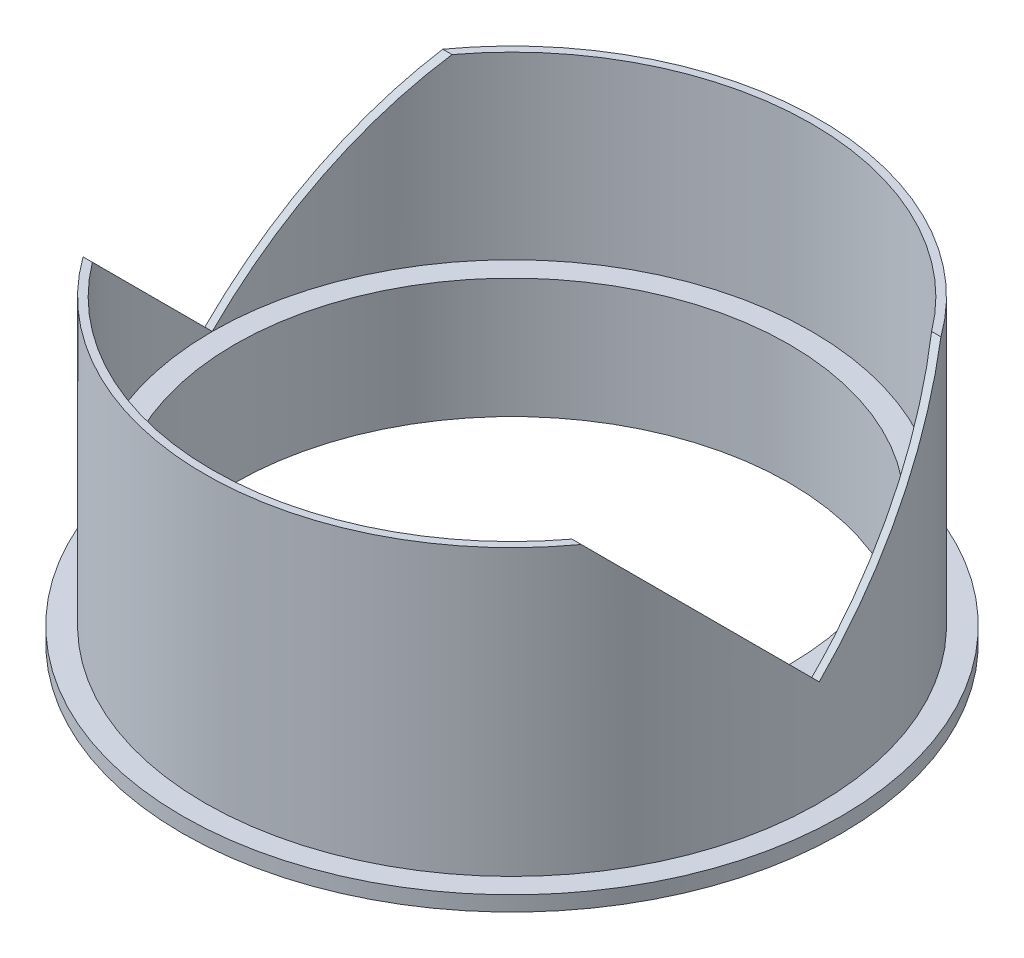
from build123d import *

# Parameters (mm, degrees)
SKETCH1_R               = 127
SKETCH1_R_2             = 117.475
BOSS_EXTRUDE1_DEPTH     = 50.8
SKETCH1_3_R             = 130.175
SKETCH1_3_R_2           = 127
BOSS_EXTRUDE2_DEPTH     = 254
SKETCH1_4_R             = 139.7
SKETCH1_4_R_2           = 130.175
BOSS_EXTRUDE3_DEPTH     = 6.35
SKETCH2_W               = 130.175
SKETCH2_H               = 127
CUT_EXTRUDE1_DEPTH      = 235.864173513
CUT_EXTRUDE1_DEPTH_BACK = 235.864173513


with BuildPart() as part:
    # Sketch1 → Boss-Extrude1 (new body)
    with BuildSketch(Plane(origin=(0, 0, 0), x_dir=(1, 0, 0), z_dir=(0, 1, 0))):
        Circle(SKETCH1_R)
        Circle(SKETCH1_R_2, mode=Mode.SUBTRACT)
    extrude(amount=BOSS_EXTRUDE1_DEPTH)

    # Sketch1<3> → Boss-Extrude2 (add)
    with BuildSketch(Plane(origin=(0, 0, 0), x_dir=(1, 0, 0), z_dir=(0, 1, 0))):
        Circle(SKETCH1_3_R)
        Circle(SKETCH1_3_R_2, mode=Mode.SUBTRACT)
    extrude(amount=BOSS_EXTRUDE2_DEPTH)

    # Sketch1<4> → Boss-Extrude3 (add)
    with BuildSketch(Plane(origin=(0, 0, 0), x_dir=(1, 0, 0), z_dir=(0, 1, 0))):
        Circle(SKETCH1_4_R)
        Circle(SKETCH1_4_R_2, mode=Mode.SUBTRACT)
    extrude(amount=BOSS_EXTRUDE3_DEPTH)

    # Sketch2 → Cut-Revolve4 (revolve, cut)
    with BuildSketch(Plane(origin=(0, 0, 0), x_dir=(0, 0, -1), z_dir=(1, 0, 0))):
        with Locations((-65.0875, 190.5)):
            Rectangle(SKETCH2_W, SKETCH2_H)
    revolve(axis=Axis((0, 254, 0), (0, -1, 0)), mode=Mode.SUBTRACT)

    # Sketch3 → Cut-Extrude1 (cut, two sides: drawn at the far end of the back side and taken through both)
    with BuildSketch(Plane(origin=(0, 0, 0), x_dir=(0, 0, -1), z_dir=(1, 0, 0)).offset(-CUT_EXTRUDE1_DEPTH_BACK)):
        Polygon((-76.2, 127), (76.2, 127), (0, 50.8), align=None)
    extrude(amount=CUT_EXTRUDE1_DEPTH + CUT_EXTRUDE1_DEPTH_BACK, mode=Mode.SUBTRACT)


solid = part.part
